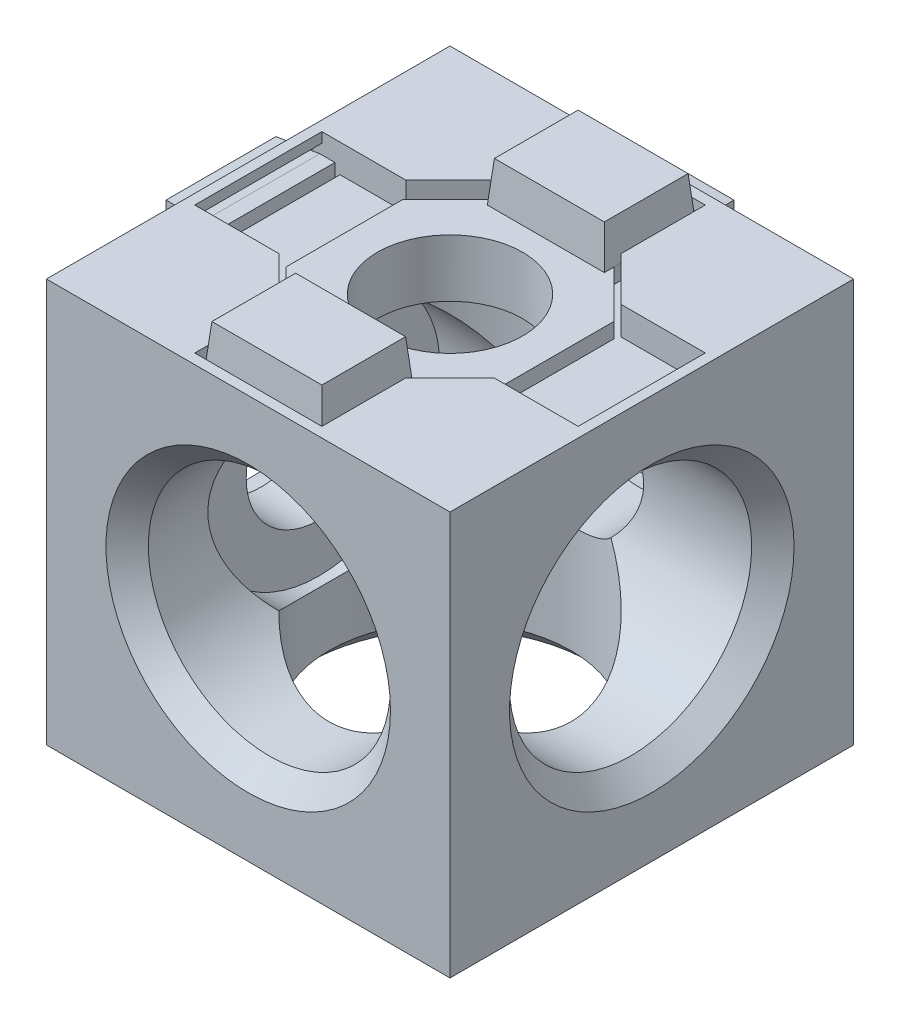
from build123d import *

# Parameters (mm, degrees)
SKETCH1_W                   = 20
SKETCH1_H                   = 20
EXTRUDE1_DEPTH              = 10
SKETCH2_R                   = 6
CUT_EXTRUDE1_DEPTH          = 25.494897428
EXTRUDE2_START              = -6
SKETCH4_R                   = 6
SKETCH4_R_2                 = 3.6
EXTRUDE2_DEPTH              = 6
CUT_EXTRUDE7_DEPTH          = 1.4
SKETCH15_R                  = 3.6
EXTRUDE4_DEPTH              = 0.75
SKETCH16_W                  = 5.8
SKETCH16_H                  = 4.5
EXTRUDE5_DEPTH              = 2
EXTRUDE5_DRAFT              = 5
EXTRUDE5_PROFILE_2_DEPTH    = 2
EXTRUDE5_PROFILE_2_DRAFT    = 5
CIRPATTERN1_COUNT           = 2
CIRPATTERN1_ANGLE           = 90
CIRPATTERN1_COPY_1_SKETCH_W = 5.8
CIRPATTERN1_COPY_1_SKETCH_H = 4.5
CIRPATTERN1_COPY_1_DEPTH    = 2
CIRPATTERN1_COPY_1_DRAFT    = 5
CIRPATTERN1_COPY_2_SKETCH_W = 5.8
CIRPATTERN1_COPY_2_SKETCH_H = 4.5
CIRPATTERN1_COPY_2_DEPTH    = 2
CIRPATTERN1_COPY_2_DRAFT    = 5
CIRPATTERN1_COPY_3_SKETCH_W = 5.8
CIRPATTERN1_COPY_3_SKETCH_H = 4.5
CIRPATTERN1_COPY_3_DEPTH    = 2
CIRPATTERN1_COPY_3_DRAFT    = 5
CIRPATTERN2_COUNT           = 2
CIRPATTERN2_ANGLE           = 90
CIRPATTERN2_COPY_1_SKETCH_W = 5.8
CIRPATTERN2_COPY_1_SKETCH_H = 4.5
CIRPATTERN2_COPY_1_DEPTH    = 2
CIRPATTERN2_COPY_1_DRAFT    = 5
CIRPATTERN2_COPY_2_SKETCH_W = 5.8
CIRPATTERN2_COPY_2_SKETCH_H = 4.5
CIRPATTERN2_COPY_2_DEPTH    = 2
CIRPATTERN2_COPY_2_DRAFT    = 5
CIRPATTERN2_COPY_3_SKETCH_W = 5.8
CIRPATTERN2_COPY_3_SKETCH_H = 4.5
CIRPATTERN2_COPY_3_DEPTH    = 2
CIRPATTERN2_COPY_3_DRAFT    = 5
SKETCH23_R                  = 6
CUT_EXTRUDE15_DEPTH         = 2.5
SKETCH24_R                  = 6
CUT_EXTRUDE16_DEPTH         = 2.5


with BuildPart() as part:
    # Sketch1 → Extrude1 (new, symmetric)
    with BuildSketch(Plane.XY):
        Rectangle(SKETCH1_W, SKETCH1_H)
    extrude(amount=EXTRUDE1_DEPTH, both=True)

    # Sketch2 → Cut-Extrude1 (cut, through all)
    with BuildSketch(Plane.XY.offset(10)):
        Circle(SKETCH2_R)
    cut_extrude1 = extrude(amount=-CUT_EXTRUDE1_DEPTH, mode=Mode.SUBTRACT)

    # Cut-Extrude2 cone 1 section (through the dimple's axis) → Cut-Extrude2 (revolve, cut)
    with BuildSketch(Plane(origin=(0, 0, 10), x_dir=(0, -1, 0), z_dir=(1, 0, 0))):
        Polygon((0, 0), (7.05, 0), (0, 7.05), align=None)
    cut_extrude2 = revolve(axis=Axis((0, 0, 10), (0, 0, -1)), mode=Mode.SUBTRACT)

    # Sketch4 → Extrude2 (add)
    with BuildSketch(Plane(origin=(0, 0, -10), x_dir=(-1, 0, 0), z_dir=(0, 0, -1)).offset(EXTRUDE2_START)):
        with Locations(Location((0, 0, 0), (0, 0, 180))):
            Circle(SKETCH4_R)
        Circle(SKETCH4_R_2, mode=Mode.SUBTRACT)
    extrude2 = extrude(amount=EXTRUDE2_DEPTH)

    # Sketch14 → Cut-Extrude7 (cut)
    with BuildSketch(Plane(origin=(0, 0, -10), x_dir=(-1, 0, 0), z_dir=(0, 0, -1))):
        Polygon((-3.15, 5.335281374), (-5.335281374, 3.15), (-9.5, 3.15), (-9.5, -3.15), (-5.335281374, -3.15), (-3.15, -5.335281374), (-3.15, -9.5), (3.15, -9.5), (3.15, -5.335281374), (5.335281374, -3.15), (9.5, -3.15), (9.5, 3.15), (5.335281374, 3.15), (3.15, 5.335281374), (3.15, 9.5), (-3.15, 9.5), align=None)
    cut_extrude7 = extrude(amount=-CUT_EXTRUDE7_DEPTH, mode=Mode.SUBTRACT)

    # Sketch15 → Extrude4 (add)
    with BuildSketch(Plane(origin=(0, 0, -8.6), x_dir=(-1, 0, 0), z_dir=(0, 0, -1))):
        Polygon((-5.231727984, 2.9), (-5.231727984, -2.9), (-2.9, -5.231727984), (-2.9, -9.25), (2.9, -9.25), (2.9, -5.231727984), (5.231727984, -2.9), (5.231727984, 2.9), (2.9, 5.231727984), (2.9, 9.25), (-2.9, 9.25), (-2.9, 5.231727984), align=None)
        Circle(SKETCH15_R, mode=Mode.SUBTRACT)
    extrude4 = extrude(amount=EXTRUDE4_DEPTH)


with BuildPart() as extrude5_tool:
    # Sketch16 → Extrude5 (with draft: the straight prism first)
    with BuildSketch(Plane(origin=(0, 0, -9.35), x_dir=(-1, 0, 0), z_dir=(0, 0, -1))):
        with Locations((0, 7)):
            Rectangle(SKETCH16_W, SKETCH16_H)
    extrude(amount=EXTRUDE5_DEPTH)
    # Extrude5: the draft: its side faces are tilted about the plane it starts from
    extrude5_sides = [extrude5_tool.faces().sort_by_distance(p)[0] for p in [
        (2.9, 7, -10.35),
        (0, 4.75, -10.35),
        (-2.9, 7, -10.35),
        (0, 9.25, -10.35),
    ]]
    draft(extrude5_sides, Plane(origin=(0, 0, -9.35), x_dir=(-1, 0, 0), z_dir=(0, 0, -1)), EXTRUDE5_DRAFT)


with BuildPart() as part_1:
    add(part.part)

    # Extrude5: add extrude5_tool
    add(extrude5_tool.part)


with BuildPart() as extrude5_profile_2_tool:
    # Sketch16 → Extrude5 profile 2 (with draft: the straight prism first)
    with BuildSketch(Plane(origin=(0, 0, -9.35), x_dir=(-1, 0, 0), z_dir=(0, 0, -1))):
        with Locations((0, -7)):
            Rectangle(SKETCH16_W, SKETCH16_H)
    extrude(amount=EXTRUDE5_PROFILE_2_DEPTH)
    # Extrude5 profile 2: the draft: its side faces are tilted about the plane it starts from
    extrude5_profile_2_sides = [extrude5_profile_2_tool.faces().sort_by_distance(p)[0] for p in [
        (0, -9.25, -10.35),
        (-2.9, -7, -10.35),
        (0, -4.75, -10.35),
        (2.9, -7, -10.35),
    ]]
    draft(extrude5_profile_2_sides, Plane(origin=(0, 0, -9.35), x_dir=(-1, 0, 0), z_dir=(0, 0, -1)), EXTRUDE5_PROFILE_2_DRAFT)


with BuildPart() as part_2:
    add(part_1.part)

    # Extrude5 profile 2: add extrude5_profile_2_tool
    add(extrude5_profile_2_tool.part)

    # CirPattern1: Cut-Extrude1, Cut-Extrude2, Extrude2, Cut-Extrude7, Extrude4 ×2 about axis
    cirpattern1_axis = Axis((0, 0, 0), (1, 0, 0))
    add([cut_extrude1.rotate(cirpattern1_axis, i * CIRPATTERN1_ANGLE / (CIRPATTERN1_COUNT - 1)) for i in range(1, CIRPATTERN1_COUNT)], mode=Mode.SUBTRACT)
    add([cut_extrude2.rotate(cirpattern1_axis, i * CIRPATTERN1_ANGLE / (CIRPATTERN1_COUNT - 1)) for i in range(1, CIRPATTERN1_COUNT)], mode=Mode.SUBTRACT)
    add([extrude2.rotate(cirpattern1_axis, i * CIRPATTERN1_ANGLE / (CIRPATTERN1_COUNT - 1)) for i in range(1, CIRPATTERN1_COUNT)])
    add([cut_extrude7.rotate(cirpattern1_axis, i * CIRPATTERN1_ANGLE / (CIRPATTERN1_COUNT - 1)) for i in range(1, CIRPATTERN1_COUNT)], mode=Mode.SUBTRACT)
    add([extrude4.rotate(cirpattern1_axis, i * CIRPATTERN1_ANGLE / (CIRPATTERN1_COUNT - 1)) for i in range(1, CIRPATTERN1_COUNT)])


with BuildPart() as cirpattern1_copy_1_tool:
    # CirPattern1 copy 1 sketch → CirPattern1 copy 1 (with draft: the straight prism first)
    with BuildSketch(Plane(origin=(0, 9.35, 0), x_dir=(-1, 0, 0), z_dir=(0, 1, 0))):
        with Locations((0, 7)):
            Rectangle(CIRPATTERN1_COPY_1_SKETCH_W, CIRPATTERN1_COPY_1_SKETCH_H)
    extrude(amount=CIRPATTERN1_COPY_1_DEPTH)
    # CirPattern1 copy 1: the draft: its side faces are tilted about the plane it starts from
    cirpattern1_copy_1_sides = [cirpattern1_copy_1_tool.faces().sort_by_distance(p)[0] for p in [
        (2.9, 10.35, 7),
        (0, 10.35, 4.75),
        (-2.9, 10.35, 7),
        (0, 10.35, 9.25),
    ]]
    draft(cirpattern1_copy_1_sides, Plane(origin=(0, 9.35, 0), x_dir=(-1, 0, 0), z_dir=(0, 1, 0)), CIRPATTERN1_COPY_1_DRAFT)


with BuildPart() as part_3:
    add(part_2.part)

    # CirPattern1 copy 1: add cirpattern1_copy_1_tool
    add(cirpattern1_copy_1_tool.part)


with BuildPart() as cirpattern1_copy_2_tool:
    # CirPattern1 copy 2 sketch → CirPattern1 copy 2 (with draft: the straight prism first)
    with BuildSketch(Plane(origin=(0, 9.35, 0), x_dir=(-1, 0, 0), z_dir=(0, 1, 0))):
        with Locations((0, -7)):
            Rectangle(CIRPATTERN1_COPY_2_SKETCH_W, CIRPATTERN1_COPY_2_SKETCH_H)
    extrude(amount=CIRPATTERN1_COPY_2_DEPTH)
    # CirPattern1 copy 2: the draft: its side faces are tilted about the plane it starts from
    cirpattern1_copy_2_sides = [cirpattern1_copy_2_tool.faces().sort_by_distance(p)[0] for p in [
        (0, 10.35, -9.25),
        (-2.9, 10.35, -7),
        (0, 10.35, -4.75),
        (2.9, 10.35, -7),
    ]]
    draft(cirpattern1_copy_2_sides, Plane(origin=(0, 9.35, 0), x_dir=(-1, 0, 0), z_dir=(0, 1, 0)), CIRPATTERN1_COPY_2_DRAFT)


with BuildPart() as part_4:
    add(part_3.part)

    # CirPattern1 copy 2: add cirpattern1_copy_2_tool
    add(cirpattern1_copy_2_tool.part)


with BuildPart() as cirpattern1_copy_3_tool:
    # CirPattern1 copy 3 sketch → CirPattern1 copy 3 (with draft: the straight prism first)
    with BuildSketch(Plane(origin=(0, 9.35, 0), x_dir=(-1, 0, 0), z_dir=(0, 1, 0))):
        with Locations((0, -7)):
            Rectangle(CIRPATTERN1_COPY_3_SKETCH_W, CIRPATTERN1_COPY_3_SKETCH_H)
    extrude(amount=CIRPATTERN1_COPY_3_DEPTH)
    # CirPattern1 copy 3: the draft: its side faces are tilted about the plane it starts from
    cirpattern1_copy_3_sides = [cirpattern1_copy_3_tool.faces().sort_by_distance(p)[0] for p in [
        (0, 10.35, -9.25),
        (-2.9, 10.35, -7),
        (0, 10.35, -4.75),
        (2.9, 10.35, -7),
    ]]
    draft(cirpattern1_copy_3_sides, Plane(origin=(0, 9.35, 0), x_dir=(-1, 0, 0), z_dir=(0, 1, 0)), CIRPATTERN1_COPY_3_DRAFT)


with BuildPart() as part_5:
    add(part_4.part)

    # CirPattern1 copy 3: add cirpattern1_copy_3_tool
    add(cirpattern1_copy_3_tool.part)

    # CirPattern2: Cut-Extrude1, Cut-Extrude2, Extrude2, Cut-Extrude7, Extrude4 ×2 about axis
    cirpattern2_axis = Axis((0, 0, 0), (0, 1, 0))
    add([cut_extrude1.rotate(cirpattern2_axis, i * CIRPATTERN2_ANGLE / (CIRPATTERN2_COUNT - 1)) for i in range(1, CIRPATTERN2_COUNT)], mode=Mode.SUBTRACT)
    add([cut_extrude2.rotate(cirpattern2_axis, i * CIRPATTERN2_ANGLE / (CIRPATTERN2_COUNT - 1)) for i in range(1, CIRPATTERN2_COUNT)], mode=Mode.SUBTRACT)
    add([extrude2.rotate(cirpattern2_axis, i * CIRPATTERN2_ANGLE / (CIRPATTERN2_COUNT - 1)) for i in range(1, CIRPATTERN2_COUNT)])
    add([cut_extrude7.rotate(cirpattern2_axis, i * CIRPATTERN2_ANGLE / (CIRPATTERN2_COUNT - 1)) for i in range(1, CIRPATTERN2_COUNT)], mode=Mode.SUBTRACT)
    add([extrude4.rotate(cirpattern2_axis, i * CIRPATTERN2_ANGLE / (CIRPATTERN2_COUNT - 1)) for i in range(1, CIRPATTERN2_COUNT)])


with BuildPart() as cirpattern2_copy_1_tool:
    # CirPattern2 copy 1 sketch → CirPattern2 copy 1 (with draft: the straight prism first)
    with BuildSketch(Plane.ZY.offset(9.35)):
        with Locations((0, 7)):
            Rectangle(CIRPATTERN2_COPY_1_SKETCH_W, CIRPATTERN2_COPY_1_SKETCH_H)
    extrude(amount=CIRPATTERN2_COPY_1_DEPTH)
    # CirPattern2 copy 1: the draft: its side faces are tilted about the plane it starts from
    cirpattern2_copy_1_sides = [cirpattern2_copy_1_tool.faces().sort_by_distance(p)[0] for p in [
        (-10.35, 7, -2.9),
        (-10.35, 4.75, 0),
        (-10.35, 7, 2.9),
        (-10.35, 9.25, 0),
    ]]
    draft(cirpattern2_copy_1_sides, Plane.ZY.offset(9.35), CIRPATTERN2_COPY_1_DRAFT)


with BuildPart() as part_6:
    add(part_5.part)

    # CirPattern2 copy 1: add cirpattern2_copy_1_tool
    add(cirpattern2_copy_1_tool.part)


with BuildPart() as cirpattern2_copy_2_tool:
    # CirPattern2 copy 2 sketch → CirPattern2 copy 2 (with draft: the straight prism first)
    with BuildSketch(Plane.ZY.offset(9.35)):
        with Locations((0, -7)):
            Rectangle(CIRPATTERN2_COPY_2_SKETCH_W, CIRPATTERN2_COPY_2_SKETCH_H)
    extrude(amount=CIRPATTERN2_COPY_2_DEPTH)
    # CirPattern2 copy 2: the draft: its side faces are tilted about the plane it starts from
    cirpattern2_copy_2_sides = [cirpattern2_copy_2_tool.faces().sort_by_distance(p)[0] for p in [
        (-10.35, -9.25, 0),
        (-10.35, -7, 2.9),
        (-10.35, -4.75, 0),
        (-10.35, -7, -2.9),
    ]]
    draft(cirpattern2_copy_2_sides, Plane.ZY.offset(9.35), CIRPATTERN2_COPY_2_DRAFT)


with BuildPart() as part_7:
    add(part_6.part)

    # CirPattern2 copy 2: add cirpattern2_copy_2_tool
    add(cirpattern2_copy_2_tool.part)


with BuildPart() as cirpattern2_copy_3_tool:
    # CirPattern2 copy 3 sketch → CirPattern2 copy 3 (with draft: the straight prism first)
    with BuildSketch(Plane.ZY.offset(9.35)):
        with Locations((0, -7)):
            Rectangle(CIRPATTERN2_COPY_3_SKETCH_W, CIRPATTERN2_COPY_3_SKETCH_H)
    extrude(amount=CIRPATTERN2_COPY_3_DEPTH)
    # CirPattern2 copy 3: the draft: its side faces are tilted about the plane it starts from
    cirpattern2_copy_3_sides = [cirpattern2_copy_3_tool.faces().sort_by_distance(p)[0] for p in [
        (-10.35, -9.25, 0),
        (-10.35, -7, 2.9),
        (-10.35, -4.75, 0),
        (-10.35, -7, -2.9),
    ]]
    draft(cirpattern2_copy_3_sides, Plane.ZY.offset(9.35), CIRPATTERN2_COPY_3_DRAFT)


with BuildPart() as part_8:
    add(part_7.part)

    # CirPattern2 copy 3: add cirpattern2_copy_3_tool
    add(cirpattern2_copy_3_tool.part)

    # Sketch23 → Cut-Extrude15 (cut)
    with BuildSketch(Plane(origin=(-4, 0, 0), x_dir=(0, 0, -1), z_dir=(1, 0, 0))):
        Circle(SKETCH23_R)
    extrude(amount=-CUT_EXTRUDE15_DEPTH, mode=Mode.SUBTRACT)

    # Sketch24 → Cut-Extrude16 (cut)
    with BuildSketch(Plane.XZ.offset(-4)):
        with Locations(Location((0, 0, 0), (0, 0, 270))):
            Circle(SKETCH24_R)
    extrude(amount=-CUT_EXTRUDE16_DEPTH, mode=Mode.SUBTRACT)


solid = part_8.part
